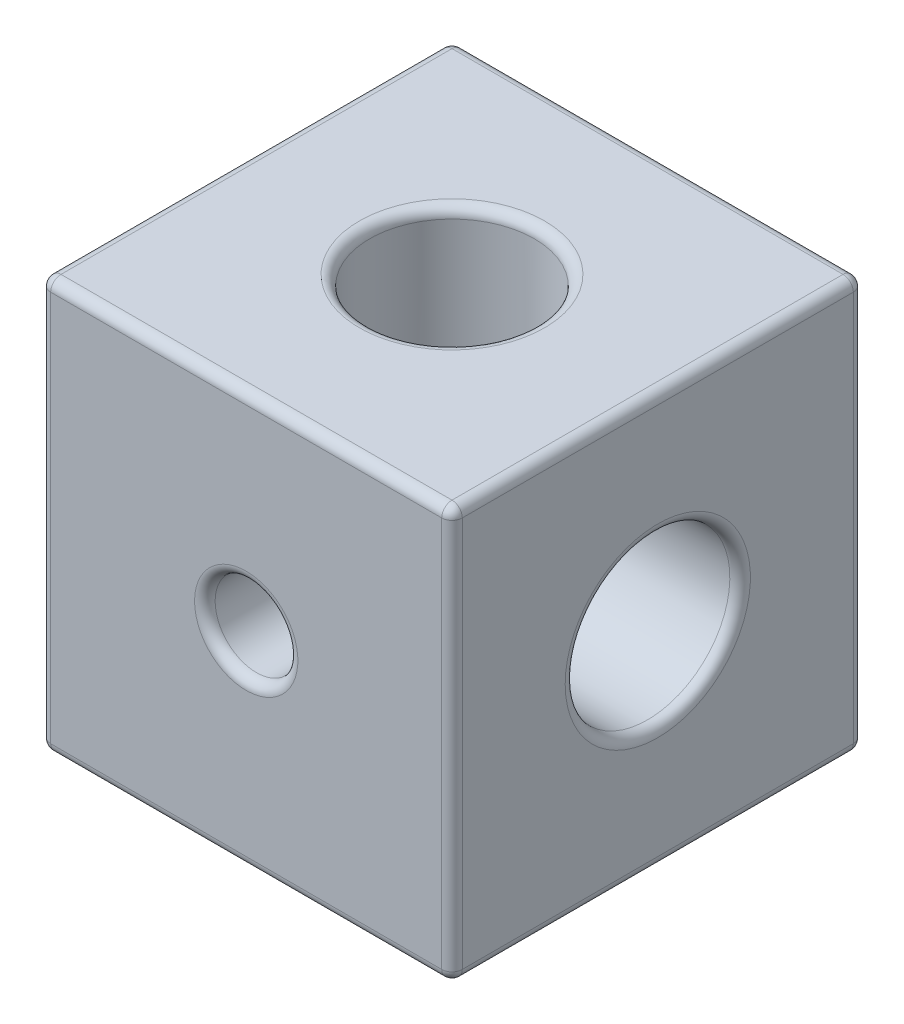
from build123d import *

# Parameters (mm, degrees)
SKETCH1_W                         = 25.4
SKETCH1_H                         = 25.4
BOSS_EXTRUDE1_DEPTH               = 25.4
F_1_4_20_TAPPED_HOLE1_D           = 5.1054
F_1_4_20_TAPPED_HOLE1_ON_FACE_2_D = 5.1054
F_1_4_20_TAPPED_HOLE1_ON_FACE_3_D = 5.1054
SKETCH7_R                         = 5.08
CUT_EXTRUDE1_DEPTH                = 12.7
SKETCH8_R                         = 5.08
CUT_EXTRUDE2_DEPTH                = 12.7
SKETCH10_R                        = 5.08
CUT_EXTRUDE3_DEPTH                = 12.7
FILLET1_R                         = 0.635


with BuildPart() as part:
    # Sketch1 → Boss-Extrude1 (new body)
    with BuildSketch(Plane.XY):
        with Locations((12.7, 12.7)):
            Rectangle(SKETCH1_W, SKETCH1_H)
    extrude(amount=BOSS_EXTRUDE1_DEPTH)

    # 1/4-20 Tapped Hole1 (through all)
    with Locations(Plane(origin=(12.7, 12.7, 25.4), x_dir=(1, 0, 0), z_dir=(0, 0, 1))):
        with Locations((0, 0)):
            Hole(F_1_4_20_TAPPED_HOLE1_D / 2)

    # 1/4-20 Tapped Hole1 on face 2 (through all)
    with Locations(Plane(origin=(25.4, 12.7, 12.7), x_dir=(0, 0, 1), z_dir=(1, 0, 0))):
        with Locations((0, 0)):
            Hole(F_1_4_20_TAPPED_HOLE1_ON_FACE_2_D / 2)

    # 1/4-20 Tapped Hole1 on face 3 (through all)
    with Locations(Plane(origin=(12.7, 25.4, 12.7), x_dir=(0, 0, 1), z_dir=(0, 1, 0))):
        with Locations((0, 0)):
            Hole(F_1_4_20_TAPPED_HOLE1_ON_FACE_3_D / 2)

    # Sketch7 → Cut-Extrude1 (cut)
    with BuildSketch(Plane(origin=(25.4, 0, 0), x_dir=(0, 0, -1), z_dir=(1, 0, 0))):
        with Locations((-12.7, 12.7)):
            Circle(SKETCH7_R)
    extrude(amount=-CUT_EXTRUDE1_DEPTH, mode=Mode.SUBTRACT)

    # Sketch8 → Cut-Extrude2 (cut)
    with BuildSketch(Plane(origin=(0, 0, 0), x_dir=(-1, 0, 0), z_dir=(0, 0, -1))):
        with Locations((-12.7, 12.7)):
            Circle(SKETCH8_R)
    extrude(amount=-CUT_EXTRUDE2_DEPTH, mode=Mode.SUBTRACT)

    # Sketch10 → Cut-Extrude3 (cut)
    with BuildSketch(Plane(origin=(0, 25.4, 0), x_dir=(1, 0, 0), z_dir=(0, 1, 0))):
        with Locations(Location((12.7, -12.7, 0), (0, 0, 270))):
            Circle(SKETCH10_R)
    extrude(amount=-CUT_EXTRUDE3_DEPTH, mode=Mode.SUBTRACT)

    # Fillet1
    fillet1_edges = [part.edges().sort_by_distance(p)[0] for p in [
        (25.4, 12.7, 25.4),
        (12.7, 0, 15.2527),
        (12.7, 25.4, 25.4),
        (0, 12.7, 15.2527),
        (15.2527, 12.7, 25.4),
        (0, 12.7, 25.4),
        (12.7, 25.4, 0),
        (25.4, 12.7, 0),
        (25.4, 12.7, 17.78),
        (12.7, 0, 0),
        (0, 12.7, 0),
        (0, 25.4, 12.7),
        (17.78, 12.7, 0),
        (25.4, 25.4, 12.7),
        (25.4, 0, 12.7),
        (0, 0, 12.7),
        (12.7, 0, 25.4),
        (12.7, 25.4, 7.62),
    ]]
    fillet(fillet1_edges, radius=FILLET1_R)


solid = part.part
